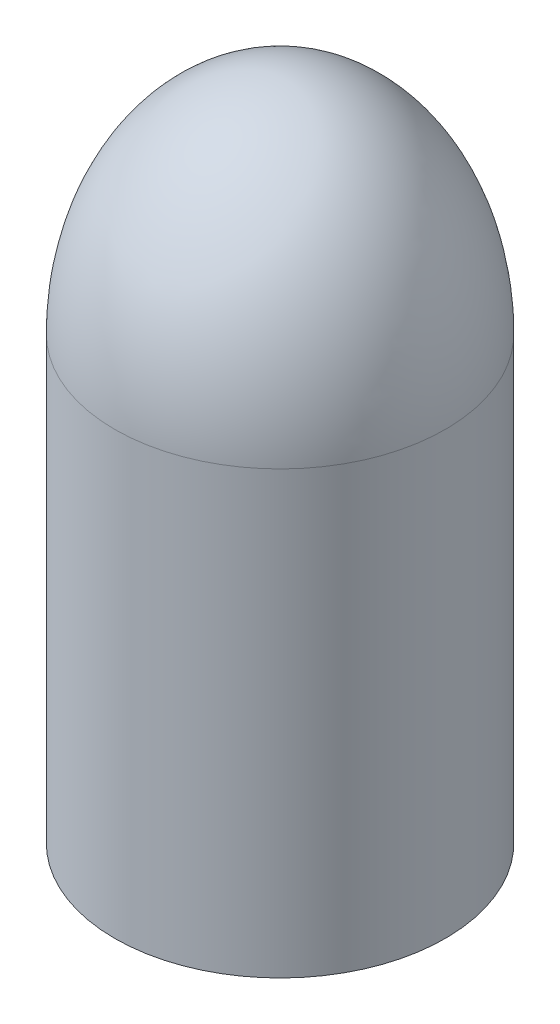
from build123d import *

# Parameters (mm, degrees)
SCHIZZO2_R                   = 1.5
ESTRUSIONE_ESTRUSIONE1_DEPTH = 4
CUPOLA1_FACE_RADIUS          = 1.5
CUPOLA1_HEIGHT               = 2


with BuildPart() as part:
    # Schizzo2 → Estrusione-Estrusione1 (new body)
    with BuildSketch(Plane(origin=(0, 0, 0), x_dir=(1, 0, 0), z_dir=(0, 1, 0))):
        Circle(SCHIZZO2_R)
    extrude(amount=ESTRUSIONE_ESTRUSIONE1_DEPTH)

    # Cupola1: an elliptical dome of height H over a round flat face of radius A is half a spheroid: the quarter ellipse of half axes A and H revolved about the face's axis
    with BuildSketch(Plane((0, 4, 0), x_dir=(0, 0, -1), z_dir=(1, 0, 0)), mode=Mode.PRIVATE) as cupola1_quarter:
        Ellipse(CUPOLA1_FACE_RADIUS, CUPOLA1_HEIGHT)
        Rectangle(CUPOLA1_FACE_RADIUS, CUPOLA1_HEIGHT, align=(Align.MIN, Align.MIN), mode=Mode.INTERSECT)
    revolve(cupola1_quarter.sketch, axis=Axis((0, 4, 0), (0, 1, 0)))


solid = part.part
